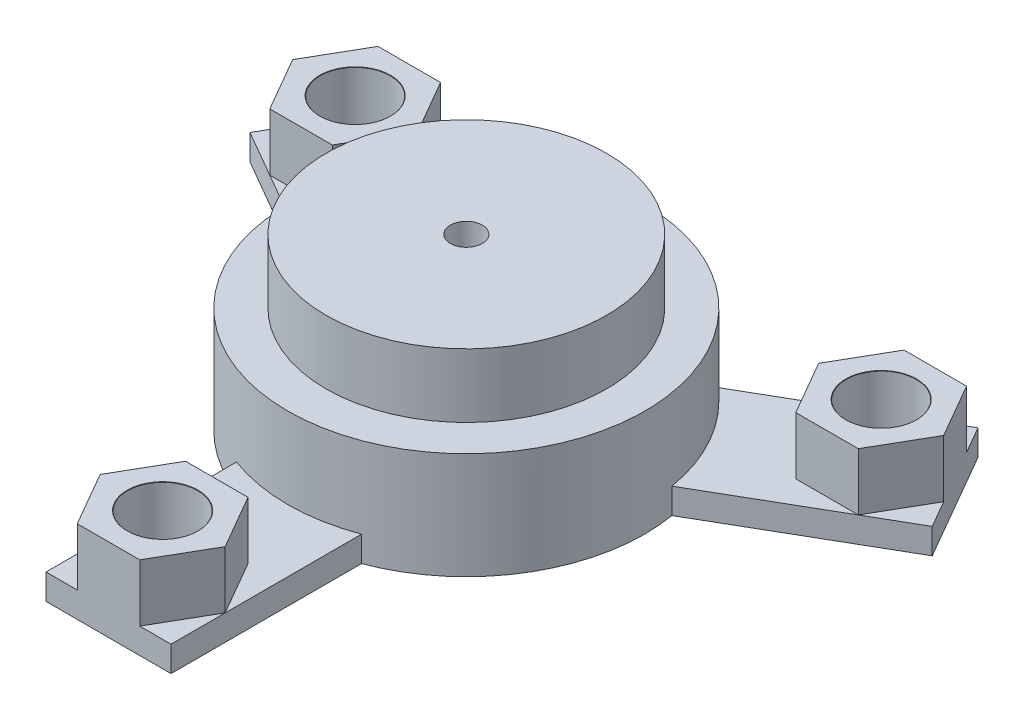
from build123d import *

# Parameters (mm, degrees)
ESQUISSE1_R                  = 11
BOSS_EXTRU_1_DEPTH           = 5
ESQUISSE3_R                  = 14
BOSS_EXTRU_3_DEPTH           = 8.35
ENL_V_MAT_EXTRU_1_DEPTH      = 24.879332068
ENL_V_MAT_EXTRU_1_DEPTH_BACK = 24.879332068
ESQUISSE5_R                  = 1.25
BOSS_EXTRU_6_DEPTH           = 2
R_P_TITION_CIRCULAIRE1_COUNT = 3
BOSS_EXTRU_8_DEPTH           = 4.5
R_P_TITION_CIRCULAIRE3_COUNT = 3
D_GAGEMENT_M51_D             = 5.5
D_GAGEMENT_M51_CSINK_D       = 5.55
D_GAGEMENT_M51_CSINK_ANGLE   = 90
R_P_TITION_CIRCULAIRE4_COUNT = 3


with BuildPart() as part:
    # Esquisse1 → Boss.-Extru.1 (new body)
    with BuildSketch(Plane(origin=(0, 0, 0), x_dir=(1, 0, 0), z_dir=(0, 1, 0))):
        with Locations(Location((0, 0, 0), (0, 0, 270))):
            Circle(ESQUISSE1_R)
    extrude(amount=BOSS_EXTRU_1_DEPTH)

    # Esquisse3 → Boss.-Extru.3 (add)
    with BuildSketch(Plane.XZ):
        with Locations(Location((0, 0, 0), (0, 0, 270))):
            Circle(ESQUISSE3_R)
    extrude(amount=BOSS_EXTRU_3_DEPTH)

    # Esquisse5 → Enlèv. mat.-Extru.1 (cut, two sides: drawn at the far end of the back side and taken through both)
    with BuildSketch(Plane.XZ.offset(8.35).offset(-ENL_V_MAT_EXTRU_1_DEPTH_BACK)):
        with Locations(Location((0, 0, 0), (0, 0, 270))):
            Circle(ESQUISSE5_R)
    extrude(amount=ENL_V_MAT_EXTRU_1_DEPTH + ENL_V_MAT_EXTRU_1_DEPTH_BACK, mode=Mode.SUBTRACT)

    # Esquisse8 → Boss.-Extru.6 (add)
    with BuildSketch(Plane.XZ.offset(8.35)):
        with BuildLine():
            Line((-4.9, 28.05), (4.9, 28.05))
            Line((4.9, 28.05), (4.9, 5.678027827))
            ThreePointArc((4.9, 5.678027827), (0, 7.5), (-4.9, 5.678027827))
            Line((-4.9, 5.678027827), (-4.9, 28.05))
        make_face()
    boss_extru_6 = extrude(amount=-BOSS_EXTRU_6_DEPTH)

    # Répétition circulaire1: Boss.-Extru.6 ×3 about axis
    r_p_tition_circulaire1_axis = Axis((0, 0, 0), (0, 1, 0))
    for i in range(1, R_P_TITION_CIRCULAIRE1_COUNT):
        add(boss_extru_6.rotate(r_p_tition_circulaire1_axis, i * 360 / R_P_TITION_CIRCULAIRE1_COUNT))

    # Esquisse13 → Boss.-Extru.8 (add)
    with BuildSketch(Plane(origin=(0, -6.35, 0), x_dir=(1, 0, 0), z_dir=(0, 1, 0))):
        Polygon((-23.067012576, 16.146762239), (-25.517012576, 11.903237761), (-23.067012576, 7.659713282), (-18.167012576, 7.659713282), (-15.717012576, 11.903237761), (-18.167012576, 16.146762239), align=None)
    boss_extru_8 = extrude(amount=BOSS_EXTRU_8_DEPTH)

    # Répétition circulaire3: Boss.-Extru.8 ×3 about axis
    r_p_tition_circulaire3_axis = Axis((0, 0, 0), (0, 1, 0))
    for i in range(1, R_P_TITION_CIRCULAIRE3_COUNT):
        add(boss_extru_8.rotate(r_p_tition_circulaire3_axis, i * 360 / R_P_TITION_CIRCULAIRE3_COUNT))

    # Dégagement M51 (through all)
    with Locations(Plane(origin=(-20.617012576, -1.85, -11.903237761), x_dir=(0, 0, 1), z_dir=(0, 1, 0))):
        with Locations((0, 0)):
            d_gagement_m51 = CounterSinkHole(D_GAGEMENT_M51_D / 2, D_GAGEMENT_M51_CSINK_D / 2, counter_sink_angle=D_GAGEMENT_M51_CSINK_ANGLE)

    # Répétition circulaire4: Dégagement M51 ×3 about axis
    r_p_tition_circulaire4_axis = Axis((0, 0, 0), (0, 1, 0))
    for i in range(1, R_P_TITION_CIRCULAIRE4_COUNT):
        add(d_gagement_m51.rotate(r_p_tition_circulaire4_axis, i * 360 / R_P_TITION_CIRCULAIRE4_COUNT), mode=Mode.SUBTRACT)


solid = part.part
